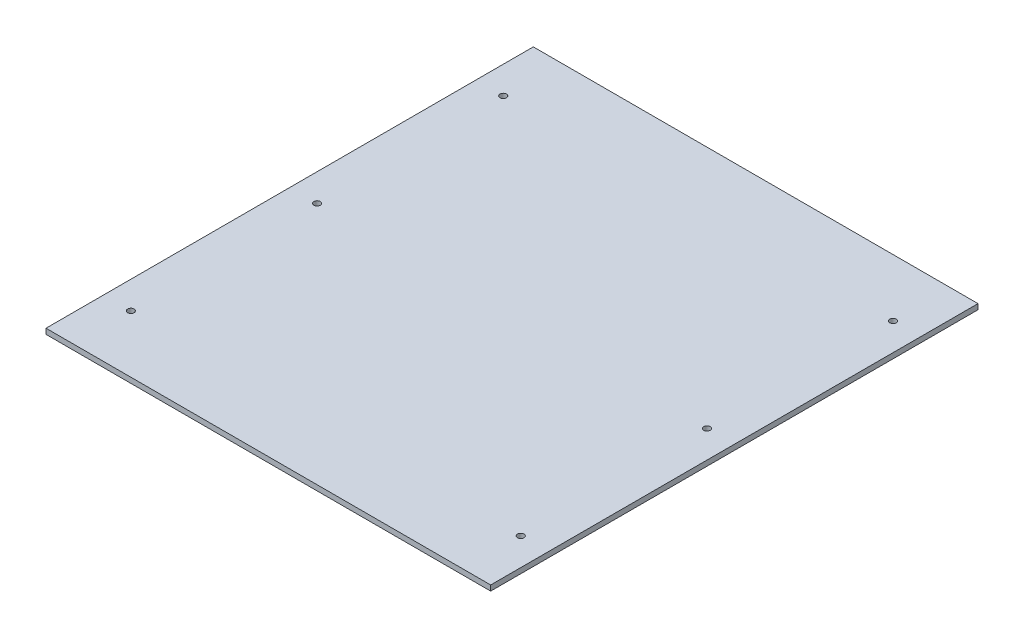
from build123d import *

# Parameters (mm, degrees)
SKETCH1_W           = 463.55
SKETCH1_H           = 508
SKETCH1_R           = 3.3782
BOSS_EXTRUDE1_DEPTH = 5.588


with BuildPart() as part:
    # Sketch1 → Boss-Extrude1 (new body)
    with BuildSketch(Plane(origin=(0, 0, 0), x_dir=(1, 0, 0), z_dir=(0, 1, 0))):
        with Locations((231.775, 254)):
            Rectangle(SKETCH1_W, SKETCH1_H)
        with Locations(Location((28.575, 59.944, 0), (0, 0, 270))):
            Circle(SKETCH1_R, mode=Mode.SUBTRACT)
        with Locations(Location((28.575, 254, 0), (0, 0, 270))):
            Circle(SKETCH1_R, mode=Mode.SUBTRACT)
        with Locations(Location((28.575, 448.056, 0), (0, 0, 270))):
            Circle(SKETCH1_R, mode=Mode.SUBTRACT)
        with Locations(Location((434.975, 448.056, 0), (0, 0, 90))):
            Circle(SKETCH1_R, mode=Mode.SUBTRACT)
        with Locations(Location((434.975, 254, 0), (0, 0, 90))):
            Circle(SKETCH1_R, mode=Mode.SUBTRACT)
        with Locations(Location((434.975, 59.944, 0), (0, 0, 90))):
            Circle(SKETCH1_R, mode=Mode.SUBTRACT)
    extrude(amount=BOSS_EXTRUDE1_DEPTH)


solid = part.part
